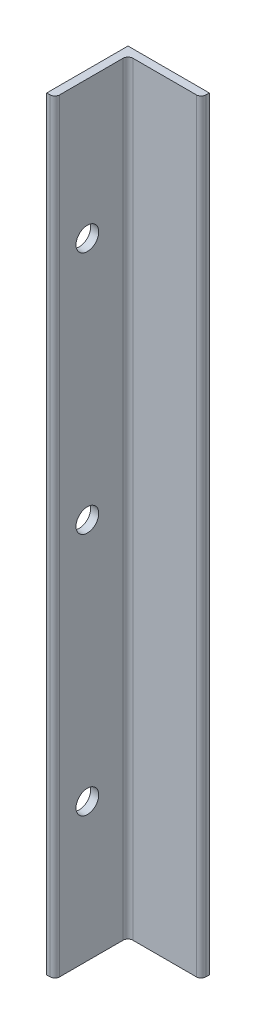
from build123d import *

# Parameters (mm, degrees)
BOSS_EXTRUDE1_DEPTH = 470
SKETCH3_R           = 7
CUT_EXTRUDE2_DEPTH  = 10


with BuildPart() as part:
    # Sketch1 → Boss-Extrude1 (new body)
    with BuildSketch(Plane(origin=(0, 0, 0), x_dir=(1, 0, 0), z_dir=(0, 1, 0))):
        with BuildLine():
            Line((-18.499872145, 39.213153277), (-68.499872145, 39.213153277))
            Line((-68.499872145, 39.213153277), (-68.499872145, -10.786846723))
            Line((-68.499872145, -10.786846723), (-66.499872145, -10.786846723))
            ThreePointArc((-66.499872145, -10.786846723), (-64.378551801, -9.908167067), (-63.499872145, -7.786846723))
            Line((-63.499872145, -7.786846723), (-63.499872145, 31.213153277))
            ThreePointArc((-63.499872145, 31.213153277), (-62.621192489, 33.334473621), (-60.499872145, 34.213153277))
            Line((-60.499872145, 34.213153277), (-21.499872145, 34.213153277))
            ThreePointArc((-21.499872145, 34.213153277), (-19.378551801, 35.091832933), (-18.499872145, 37.213153277))
            Line((-18.499872145, 37.213153277), (-18.499872145, 39.213153277))
        make_face()
    extrude(amount=BOSS_EXTRUDE1_DEPTH)

    # Sketch3 → Cut-Extrude2 (cut)
    with BuildSketch(Plane(origin=(-63.499872145, 0, 0), x_dir=(0, 0, -1), z_dir=(1, 0, 0))):
        with Locations((9.213153277, 235)):
            Circle(SKETCH3_R)
        with Locations((9.213153277, 85)):
            Circle(SKETCH3_R)
        with Locations((9.213153277, 385)):
            Circle(SKETCH3_R)
    extrude(amount=-CUT_EXTRUDE2_DEPTH, mode=Mode.SUBTRACT)


solid = part.part
